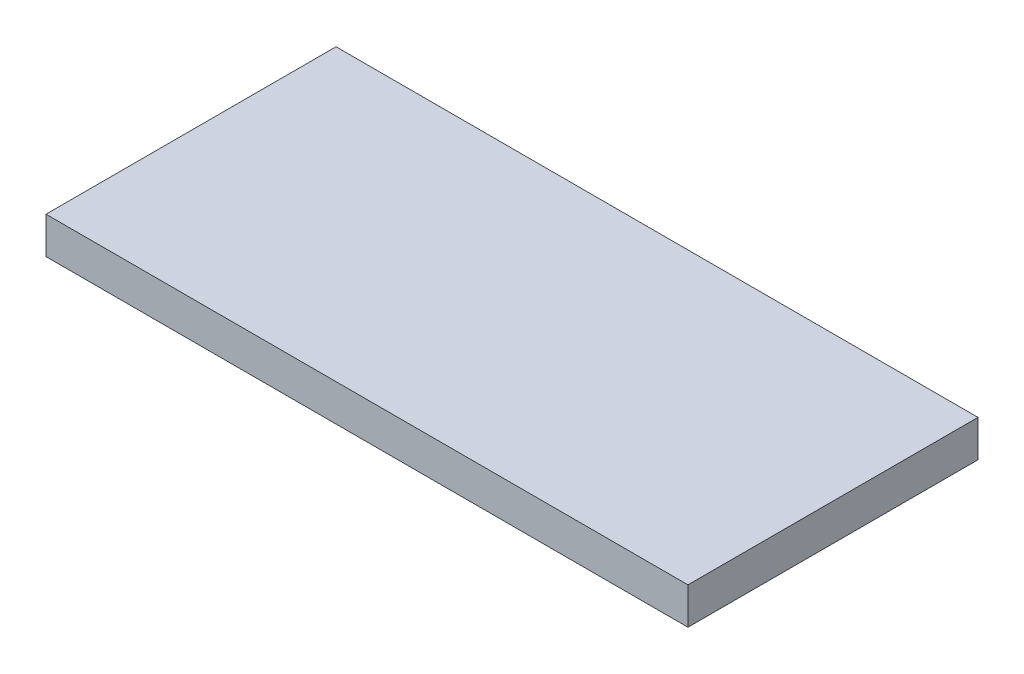
from build123d import *

# Parameters (mm, degrees)
CROQUIS3_W              = 332
CROQUIS3_H              = 150
SALIENTE_EXTRUIR1_DEPTH = 19


with BuildPart() as part:
    # Croquis3 → Saliente-Extruir1 (new body)
    with BuildSketch(Plane(origin=(0, 0, 0), x_dir=(1, 0, 0), z_dir=(0, 1, 0))):
        with Locations((27.471454939, 2.071428571)):
            Rectangle(CROQUIS3_W, CROQUIS3_H)
    extrude(amount=SALIENTE_EXTRUIR1_DEPTH)


solid = part.part
